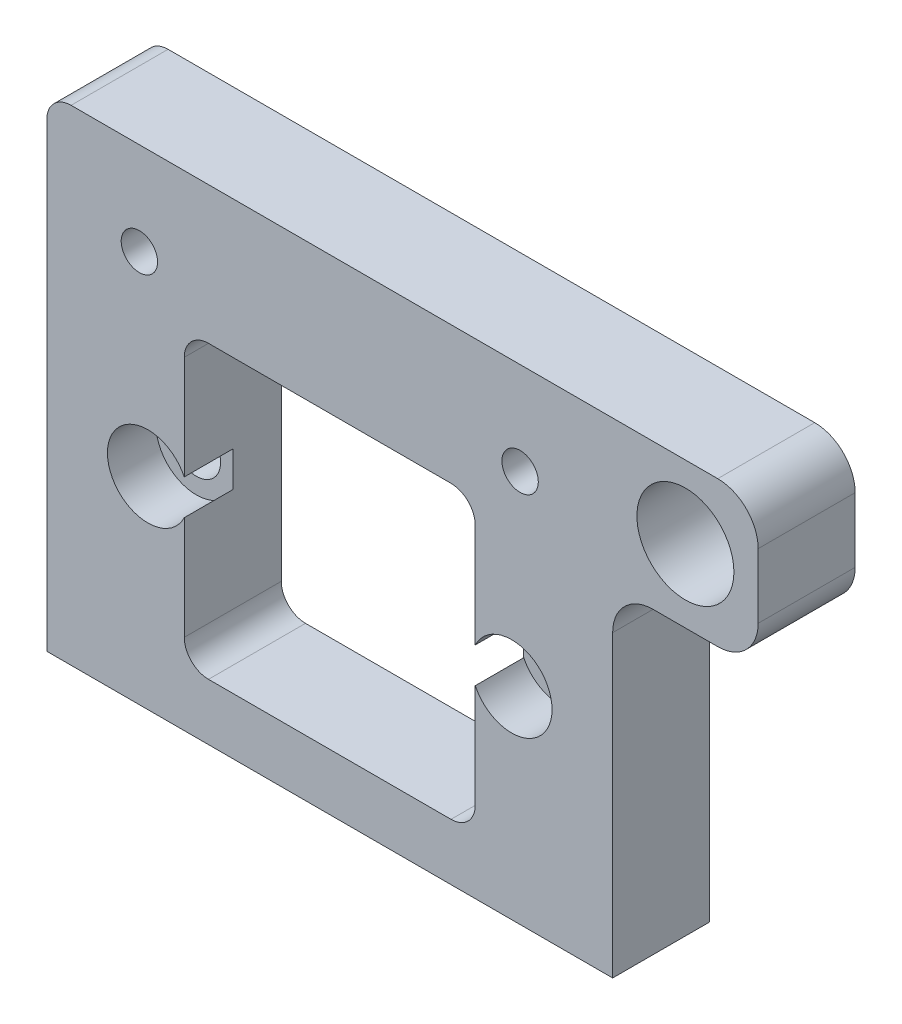
from build123d import *

# Parameters (mm, degrees)
ESQUISSE1_R             = 6
BOSS_EXTRU_1_DEPTH      = 12
ESQUISSE2_R             = 3
ENL_V_MAT_EXTRU_1_DEPTH = 12
ESQUISSE3_R             = 5
ENL_V_MAT_EXTRU_2_DEPTH = 6
ENL_V_MAT_EXTRU_3_REACH = 109.182
ESQUISSE4_R             = 2.25


with BuildPart() as part:
    # Esquisse1 → Boss.-Extru.1 (new body)
    with BuildSketch(Plane.XY):
        with BuildLine():
            Line((0, 0), (70, 0))
            Line((70, 0), (70, 37))
            ThreePointArc((70, 37), (71.464466094, 40.535533906), (75, 42))
            Line((75, 42), (83, 42))
            ThreePointArc((83, 42), (86.535533906, 43.464466094), (88, 47))
            Line((88, 47), (88, 55))
            ThreePointArc((88, 55), (86.535533906, 58.535533906), (83, 60))
            Line((83, 60), (70, 60))
            Line((70, 60), (3, 60))
            ThreePointArc((3, 60), (0.878679656, 59.121320344), (0, 57))
            Line((0, 57), (0, 0))
        make_face()
        with Locations((79, 51)):
            Circle(ESQUISSE1_R, mode=Mode.SUBTRACT)
        with BuildLine():
            Line((20, 7), (50, 7))
            ThreePointArc((50, 7), (52.121320344, 7.878679656), (53, 10))
            Line((53, 10), (53, 40))
            ThreePointArc((53, 40), (52.121320344, 42.121320344), (50, 43))
            Line((50, 43), (20, 43))
            ThreePointArc((20, 43), (17.878679656, 42.121320344), (17, 40))
            Line((17, 40), (17, 10))
            ThreePointArc((17, 10), (17.878679656, 7.878679656), (20, 7))
        make_face(mode=Mode.SUBTRACT)
    extrude(amount=BOSS_EXTRU_1_DEPTH)

    # Esquisse2 → Enlèv. mat.-Extru.1 (cut)
    with BuildSketch(Plane.XY.offset(12)):
        with Locations((12.5, 25)):
            Circle(ESQUISSE2_R)
        with Locations(Location((57.5, 25, 0), (0, 0, 180))):
            Circle(ESQUISSE2_R)
    extrude(amount=-ENL_V_MAT_EXTRU_1_DEPTH, mode=Mode.SUBTRACT)

    # Esquisse3 → Enlèv. mat.-Extru.2 (cut)
    with BuildSketch(Plane.XY.offset(12)):
        with Locations((12.5, 25)):
            Circle(ESQUISSE3_R)
        with Locations((57.5, 25)):
            Circle(ESQUISSE3_R)
    extrude(amount=-ENL_V_MAT_EXTRU_2_DEPTH, mode=Mode.SUBTRACT)

    # Esquisse4 → Enlèv. mat.-Extru.3 (cut, up to next)
    with BuildSketch(Plane.XY.offset(12), mode=Mode.PRIVATE) as enl_v_mat_extru_3_sk1:
        with Locations((11.45, 48.55)):
            Circle(ESQUISSE4_R)
    enl_v_mat_extru_3_tool1 = extrude(enl_v_mat_extru_3_sk1.sketch, amount=-ENL_V_MAT_EXTRU_3_REACH, mode=Mode.PRIVATE) & part.part
    # Esquisse4 → Enlèv. mat.-Extru.3 (cut, up to next)
    with BuildSketch(Plane.XY.offset(12), mode=Mode.PRIVATE) as enl_v_mat_extru_3_sk2:
        with Locations((58.55, 48.55)):
            Circle(ESQUISSE4_R)
    enl_v_mat_extru_3_tool2 = extrude(enl_v_mat_extru_3_sk2.sketch, amount=-ENL_V_MAT_EXTRU_3_REACH, mode=Mode.PRIVATE) & part.part
    add(enl_v_mat_extru_3_tool1.solids().sort_by_distance((11.45, 48.55, 12))[0], mode=Mode.SUBTRACT)
    add(enl_v_mat_extru_3_tool2.solids().sort_by_distance((58.55, 48.55, 12))[0], mode=Mode.SUBTRACT)


solid = part.part
